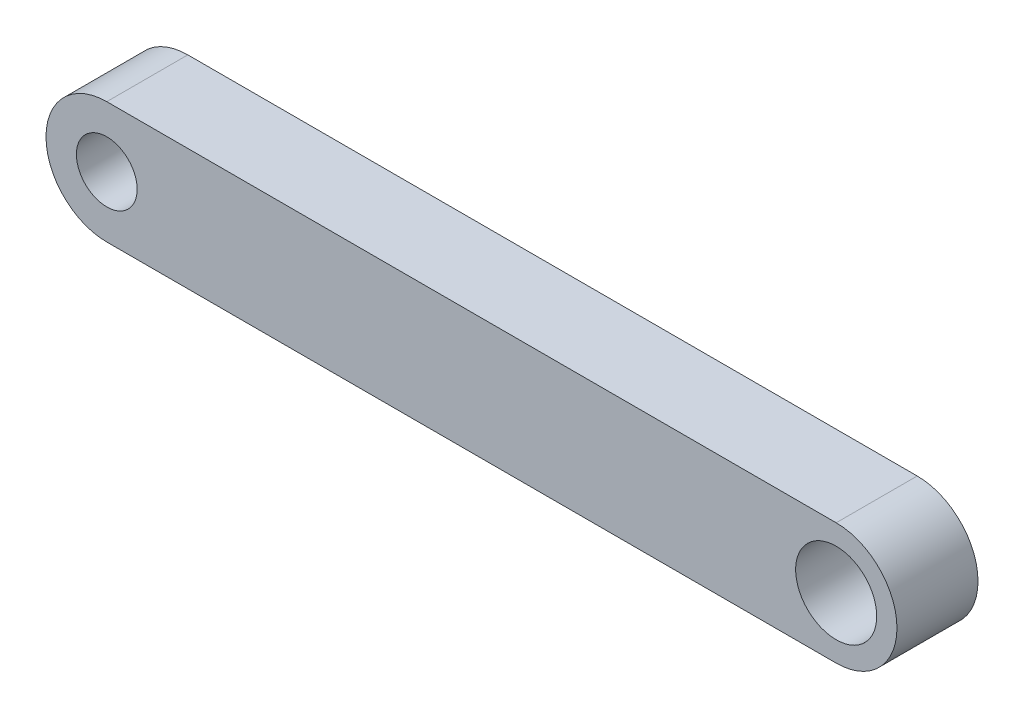
from build123d import *

# Parameters (mm, degrees)
SKETCH1_R           = 2
SKETCH1_R_2         = 1.5
BOSS_EXTRUDE1_DEPTH = 4


with BuildPart() as part:
    # Sketch1 → Boss-Extrude1 (new body)
    with BuildSketch(Plane.XY):
        with BuildLine():
            Line((0, 3), (-36, 3))
            ThreePointArc((-36, 3), (-39, 0), (-36, -3))
            Line((-36, -3), (0, -3))
            ThreePointArc((0, -3), (3, 0), (0, 3))
        make_face()
        Circle(SKETCH1_R, mode=Mode.SUBTRACT)
        with Locations(Location((-36, 0, 0), (0, 0, 180))):
            Circle(SKETCH1_R_2, mode=Mode.SUBTRACT)
    extrude(amount=BOSS_EXTRUDE1_DEPTH)


solid = part.part
